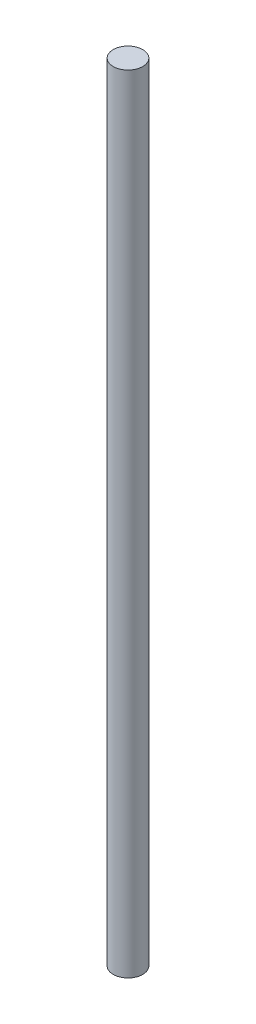
from build123d import *

# Parameters (mm, degrees)
SKETCH1_R           = 3.75
BOSS_EXTRUDE1_DEPTH = 200


with BuildPart() as part:
    # Sketch1 → Boss-Extrude1 (new body)
    with BuildSketch(Plane(origin=(0, 0, 0), x_dir=(1, 0, 0), z_dir=(0, 1, 0))):
        Circle(SKETCH1_R)
    extrude(amount=BOSS_EXTRUDE1_DEPTH)


solid = part.part
